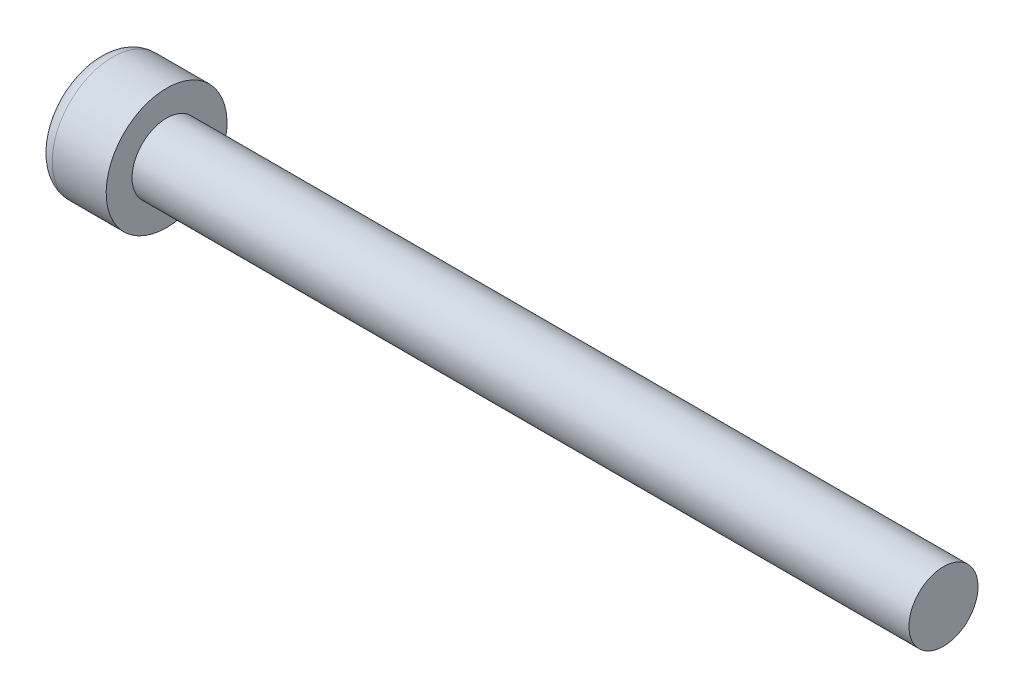
from build123d import *

# Parameters (mm, degrees)
CUT_EXTRUDE1_DEPTH = 2


with BuildPart() as part:
    # Sketch1 → Revolve1 (revolve)
    with BuildSketch(Plane.XY, mode=Mode.PRIVATE) as revolve1_sk:
        with BuildLine():
            Line((0, 0), (0, 2.625))
            ThreePointArc((0, 2.625), (0.256281566, 3.243718434), (0.875, 3.5))
            Line((0.875, 3.5), (4, 3.5))
            Line((4, 3.5), (4, 2))
            Line((4, 2), (49, 2))
            Line((49, 2), (49, 0))
            Line((49, 0), (0, 0))
        make_face()
    revolve(revolve1_sk.sketch.rotate(Axis((0, 0, 0), (1, 0, 0)), 180), axis=Axis((0, 0, 0), (1, 0, 0)))

    # Sketch2 → Cut-Extrude1 (cut)
    with BuildSketch(Plane.ZY):
        Polygon((0, 1.732050808), (-1.5, 0.866025404), (-1.5, -0.866025404), (0, -1.732050808), (1.5, -0.866025404), (1.5, 0.866025404), align=None)
    extrude(amount=-CUT_EXTRUDE1_DEPTH, mode=Mode.SUBTRACT)


solid = part.part
